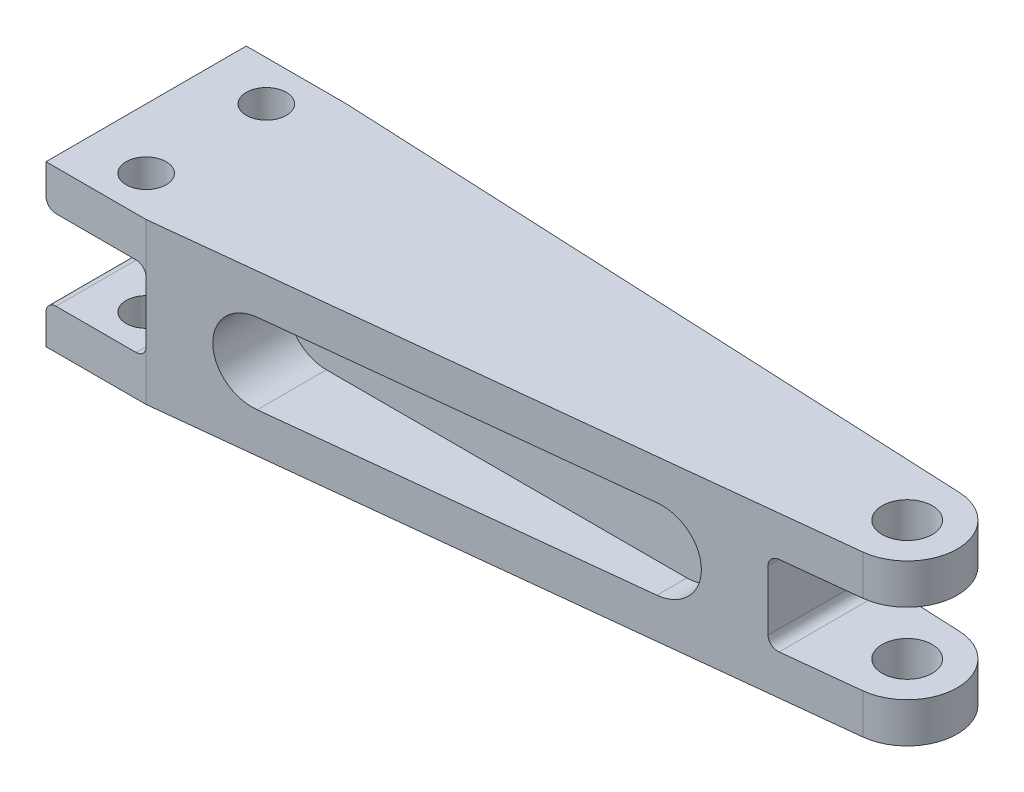
from build123d import *

# Parameters (mm, degrees)
SKETCH1_R               = 3.96875
SKETCH1_R_2             = 3.175
BOSS_EXTRUDE1_DEPTH     = 12.7
CUT_EXTRUDE1_DEPTH      = 120.685287839
CUT_EXTRUDE1_DEPTH_BACK = 120.685287839
SKETCH2_W               = 25.4
SKETCH2_H               = 12.7
SKETCH2_W_2             = 19.05
FILLET1_R               = 1.5875
FILLET2_R               = 1.5875
CUT_EXTRUDE2_DEPTH      = 12.7
CUT_EXTRUDE3_START      = -12.7
CUT_EXTRUDE3_DEPTH      = 12.7


with BuildPart() as part:
    # Sketch1 → Boss-Extrude1 (new, symmetric)
    with BuildSketch(Plane(origin=(0, 0, 0), x_dir=(1, 0, 0), z_dir=(0, 1, 0))):
        with BuildLine():
            Line((-117.475, 12.7), (-101.6, 12.7))
            Line((-101.6, 12.7), (0.370986014, 7.928825615))
            ThreePointArc((0.370986014, 7.928825615), (7.933719481, 0.24495193), (0.859414796, -7.890837247))
            Line((0.859414796, -7.890837247), (-101.6, -19.05))
            Line((-101.6, -19.05), (-117.475, -19.05))
            Line((-117.475, -19.05), (-117.475, 12.7))
        make_face()
        with Locations(Location((0, 0, 0), (0, 0, 270))):
            Circle(SKETCH1_R, mode=Mode.SUBTRACT)
        with Locations(Location((-107.95, 6.35, 0), (0, 0, 270))):
            Circle(SKETCH1_R_2, mode=Mode.SUBTRACT)
        with Locations(Location((-107.95, -12.7, 0), (0, 0, 270))):
            Circle(SKETCH1_R_2, mode=Mode.SUBTRACT)
    extrude(amount=BOSS_EXTRUDE1_DEPTH, both=True)

    # Sketch2 → Cut-Extrude1 (cut, two sides: drawn at the far end of the back side and taken through both)
    with BuildSketch(Plane.XY.offset(-CUT_EXTRUDE1_DEPTH_BACK)):
        Rectangle(SKETCH2_W, SKETCH2_H)
        with Locations((-111.125, 0)):
            Rectangle(SKETCH2_W_2, SKETCH2_H)
    extrude(amount=CUT_EXTRUDE1_DEPTH + CUT_EXTRUDE1_DEPTH_BACK, mode=Mode.SUBTRACT)

    # Fillet1
    fillet1_edges = [part.edges().sort_by_distance(p)[0] for p in [
        (-12.7, -6.35, 0.413611484),
        (-12.7, 6.35, 0.413611484),
        (-101.6, -6.35, 3.175),
        (-101.6, 6.35, 3.175),
    ]]
    fillet(fillet1_edges, radius=FILLET1_R)

    # Fillet2
    fillet2_edges = [part.edges().sort_by_distance(p)[0] for p in [
        (-117.475, 6.35, 3.175),
        (-117.475, -6.35, 3.175),
    ]]
    fillet(fillet2_edges, radius=FILLET2_R)

    # Sketch3 → Cut-Extrude2 (cut)
    with BuildSketch(Plane(origin=(0, 0, -12.7), x_dir=(-1, 0, 0), z_dir=(0, 0, -1))):
        with BuildLine():
            Line((28.575, 6.35), (85.725, 6.35))
            ThreePointArc((85.725, 6.35), (92.075, 0), (85.725, -6.35))
            Line((85.725, -6.35), (28.575, -6.35))
            ThreePointArc((28.575, -6.35), (22.225, 0), (28.575, 6.35))
        make_face()
    extrude(amount=-CUT_EXTRUDE2_DEPTH, mode=Mode.SUBTRACT)

    # Sketch4 → Cut-Extrude3 (cut)
    with BuildSketch(Plane.XY.offset(19.05).offset(CUT_EXTRUDE3_START)):
        with BuildLine():
            Line((-28.575, 6.35), (-85.725, 6.35))
            ThreePointArc((-85.725, 6.35), (-92.075, 0), (-85.725, -6.35))
            Line((-85.725, -6.35), (-28.575, -6.35))
            ThreePointArc((-28.575, -6.35), (-22.225, 0), (-28.575, 6.35))
        make_face()
    extrude(amount=CUT_EXTRUDE3_DEPTH, mode=Mode.SUBTRACT)


solid = part.part
